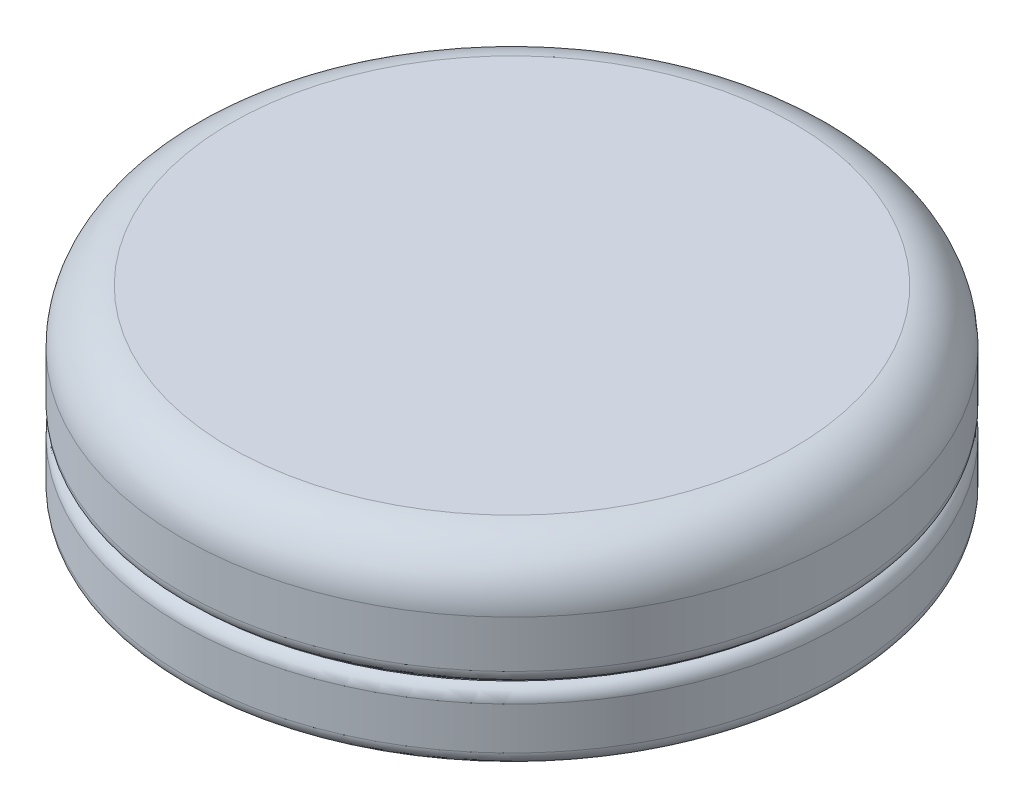
from build123d import *


with BuildPart() as part:
    # Sketch2 → Revolve2 (revolve)
    with BuildSketch(Plane.XY, mode=Mode.PRIVATE) as revolve2_sk:
        with BuildLine():
            Line((0, 0), (0, 10.034926072))
            Line((0, 10.034926072), (-15.174290575, 10.034926072))
            ThreePointArc((-15.174290575, 10.034926072), (-17.033998604, 9.069882685), (-17.78, 7.112))
            Line((-17.78, 7.112), (-17.78, 4.572))
            ThreePointArc((-17.78, 4.572), (-17.640170395, 4.132059095), (-17.272, 3.85357951))
            Line((-17.272, 3.85357951), (-17.272, 3.76642049))
            ThreePointArc((-17.272, 3.76642049), (-17.640170395, 3.487940905), (-17.78, 3.048))
            Line((-17.78, 3.048), (-17.78, 0.762))
            ThreePointArc((-17.78, 0.762), (-17.556815367, 0.223184633), (-17.018, 0))
            Line((-17.018, 0), (0, 0))
        make_face()
    revolve(revolve2_sk.sketch.rotate(Axis((0, 0, 0), (0, 1, 0)), 270), axis=Axis((0, 0, 0), (0, 1, 0)))


solid = part.part
